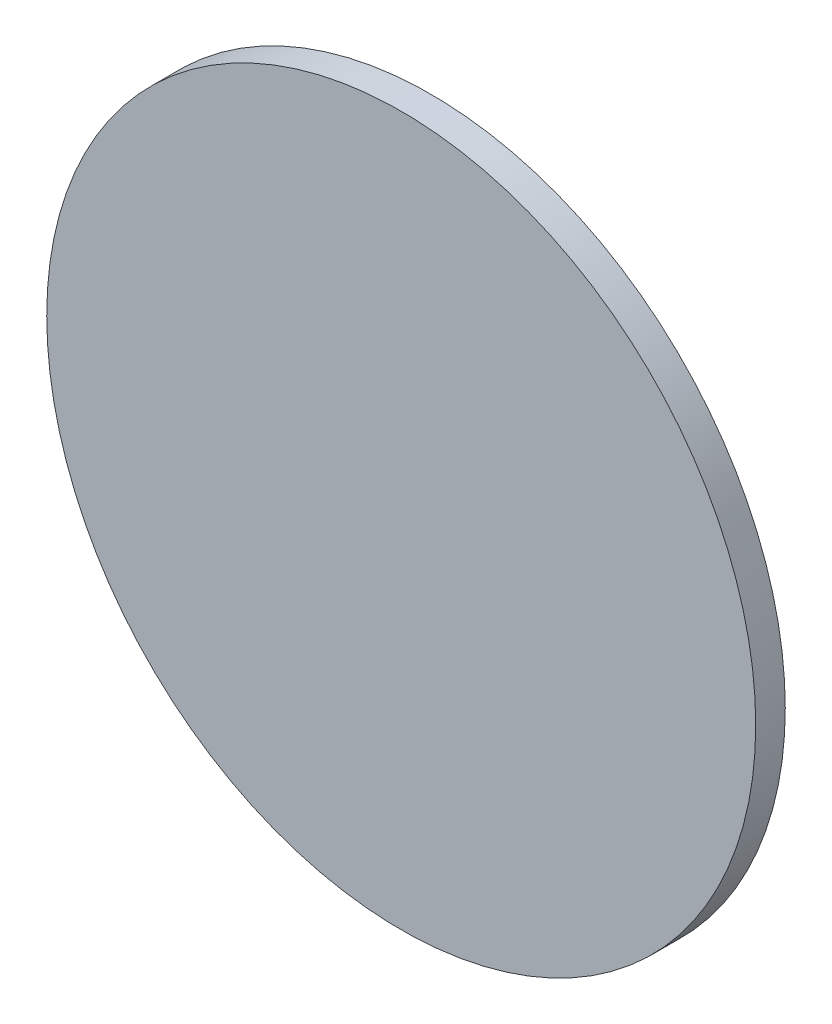
from build123d import *

# Parameters (mm, degrees)
SKETCH1_R           = 60
BOSS_EXTRUDE1_DEPTH = 5


with BuildPart() as part:
    # Sketch1 → Boss-Extrude1 (new body)
    with BuildSketch(Plane.XY):
        Circle(SKETCH1_R)
    extrude(amount=BOSS_EXTRUDE1_DEPTH)


solid = part.part
